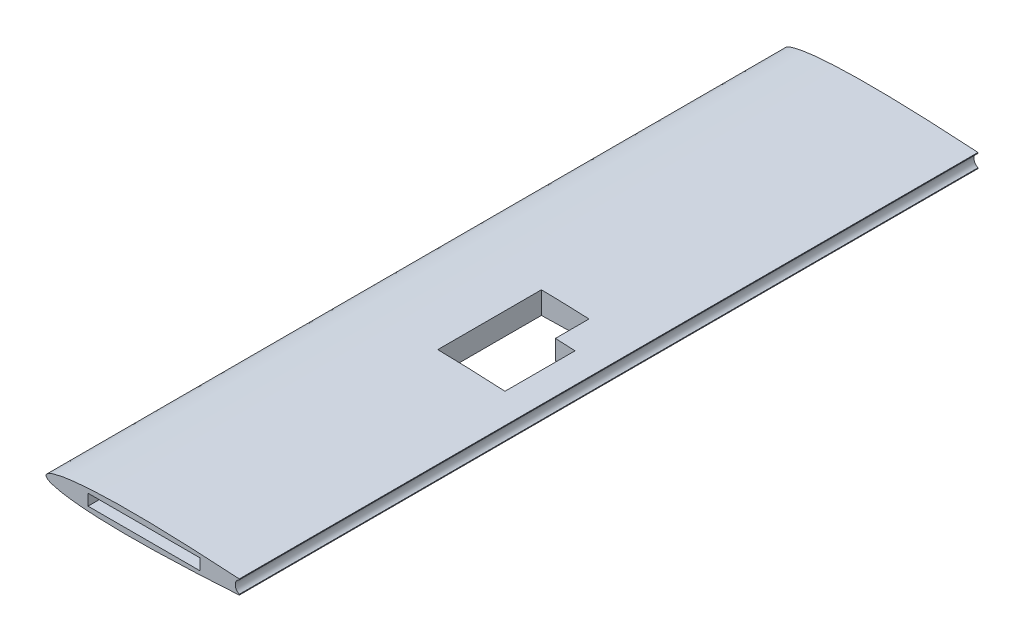
from build123d import *

# Parameters (mm, degrees)
CORPOFOAM_DEPTH              = 263.67
SCHIZZO2_W                   = 3
SCHIZZO2_H                   = 5.01489576
SMUSSOPOSTERIORE_DEPTH       = 273.833056966
TAGLIOSERVOMOTORE_DEPTH      = 273.578203408
TAGLIOSERVOMOTORE_DEPTH_BACK = 273.578203408
SCHIZZO6_W                   = 40
SCHIZZO6_H                   = 4
TAGLIOSPINASINISTRA_DEPTH    = 18


with BuildPart() as part:
    # Schizzo1 → CorpoFoam (new body)
    with BuildSketch(Plane.XY):
        with BuildLine():
            ThreePointArc((70, 2.443), (67.557, 0), (70, -2.443))
            add(Edge.make_bspline(
                [(70, 2.443), (66.667669045, 2.659279734), (60.003104625, 3.061747723), (50.003008601, 3.552139212), (40.002598558, 3.902946494), (31.666961486, 4.025260151), (24.9991546, 3.976933791), (19.997775587, 3.844976398), (14.993363131, 3.592486959), (10.827184065, 3.237651579), (7.489054388, 2.814021367), (4.99359465, 2.403673059), (2.84962634, 1.867925494), (1.165413503, 1.320987252), (-0.664613784, 0), (1.165413503, -1.320987252), (2.84962634, -1.867925494), (4.99359465, -2.403673059), (7.489054388, -2.814021367), (10.827184065, -3.237651579), (14.993363131, -3.592486959), (19.997775587, -3.844976398), (24.9991546, -3.976933791), (31.666961486, -4.025260151), (40.002598558, -3.902946494), (50.003008601, -3.552139212), (60.003104625, -3.061747723), (66.667669045, -2.659279734), (70, -2.443)],
                knots=[0.149112224, 0.149112224, 0.149112224, 0.149112224, 0.198750974, 0.248359097, 0.29793737, 0.347491327, 0.37226694, 0.397050924, 0.421859475, 0.446731346, 0.459220451, 0.471790602, 0.484560454, 0.491195112, 0.5, 0.508804888, 0.515439546, 0.528209398, 0.540779549, 0.553268654, 0.578140525, 0.602949076, 0.62773306, 0.652508673, 0.70206263, 0.751640903, 0.801249026, 0.850887776, 0.850887776, 0.850887776, 0.850887776], degree=3))
        make_face()
    extrude(amount=CORPOFOAM_DEPTH)

    # Schizzo2 → SmussoPosteriore (cut, through all)
    with BuildSketch(Plane.XY.offset(263.67)):
        with Locations((70.5, 0)):
            Rectangle(SCHIZZO2_W, SCHIZZO2_H)
    extrude(amount=-SMUSSOPOSTERIORE_DEPTH, mode=Mode.SUBTRACT)

    # Schizzo5 → TaglioServomotore (cut, two sides: drawn at the far end of the back side and taken through both)
    with BuildSketch(Plane(origin=(0, 0, 0), x_dir=(1, 0, 0), z_dir=(0, 1, 0)).offset(-TAGLIOSERVOMOTORE_DEPTH_BACK)):
        Polygon((52, -133.835), (59, -133.835), (59, -158.835), (35, -158.835), (35, -133.835), (35, -121.835), (52, -121.835), align=None)
    extrude(amount=TAGLIOSERVOMOTORE_DEPTH + TAGLIOSERVOMOTORE_DEPTH_BACK, mode=Mode.SUBTRACT)

    # Schizzo6 → TaglioSpinaSinistra (cut)
    with BuildSketch(Plane.XY.offset(263.67)):
        with Locations((35, 0)):
            Rectangle(SCHIZZO6_W, SCHIZZO6_H)
    tagliospinasinistra = extrude(amount=-TAGLIOSPINASINISTRA_DEPTH, mode=Mode.SUBTRACT)

    # TaglioSpinaDestra: TaglioSpinaSinistra across plane
    add(tagliospinasinistra.mirror(Plane.XY.offset(131.835)), mode=Mode.SUBTRACT)


solid = part.part
